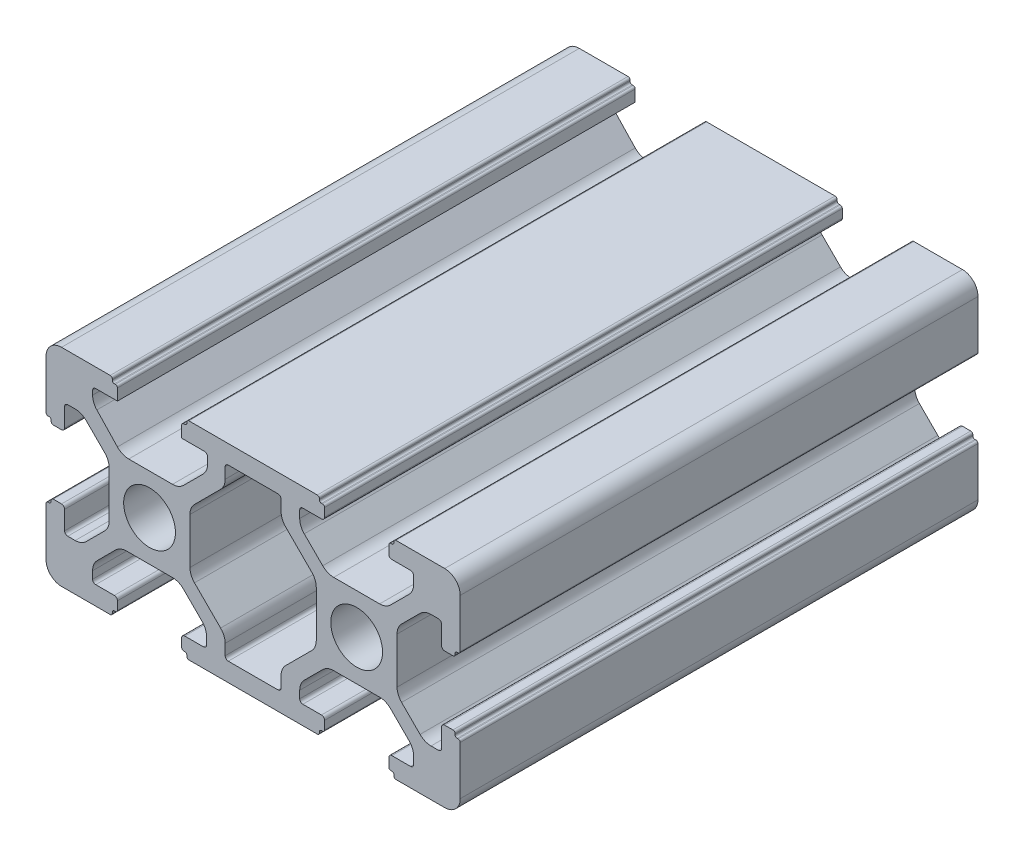
from build123d import *

# Parameters (mm, degrees)
SKETCH1_R           = 2.5
BOSS_EXTRUDE2_DEPTH = 50


with BuildPart() as part:
    # Sketch1 → Boss-Extrude2 (new body)
    with BuildSketch(Plane.XY):
        with BuildLine():
            Line((1.5, 0), (6.2, 0))
            ThreePointArc((6.2, 0), (6.341421356, 0.058578644), (6.4, 0.2))
            Line((6.4, 0.2), (6.4, 0.3))
            ThreePointArc((6.4, 0.3), (6.458578644, 0.441421356), (6.6, 0.5))
            Line((6.6, 0.5), (6.7, 0.5))
            ThreePointArc((6.7, 0.5), (6.841421356, 0.558578644), (6.9, 0.7))
            Line((6.9, 0.7), (6.9, 1.5))
            ThreePointArc((6.9, 1.5), (6.812132034, 1.712132034), (6.6, 1.8))
            Line((6.6, 1.8), (4.8, 1.8))
            ThreePointArc((4.8, 1.8), (4.587867966, 1.887867966), (4.5, 2.1))
            Line((4.5, 2.1), (4.5, 2.818019485))
            ThreePointArc((4.5, 2.818019485), (4.614180701, 3.392044633), (4.939339828, 3.878679656))
            Line((4.939339828, 3.878679656), (6.721320344, 5.660660172))
            ThreePointArc((6.721320344, 5.660660172), (7.207955367, 5.985819299), (7.781980515, 6.1))
            Line((7.781980515, 6.1), (12.218019485, 6.1))
            ThreePointArc((12.218019485, 6.1), (12.792044633, 5.985819299), (13.278679656, 5.660660172))
            Line((13.278679656, 5.660660172), (15.060660172, 3.878679656))
            ThreePointArc((15.060660172, 3.878679656), (15.385819299, 3.392044633), (15.5, 2.818019485))
            Line((15.5, 2.818019485), (15.5, 2.1))
            ThreePointArc((15.5, 2.1), (15.412132034, 1.887867966), (15.2, 1.8))
            Line((15.2, 1.8), (13.4, 1.8))
            ThreePointArc((13.4, 1.8), (13.187867966, 1.712132034), (13.1, 1.5))
            Line((13.1, 1.5), (13.1, 0.7))
            ThreePointArc((13.1, 0.7), (13.158578644, 0.558578644), (13.3, 0.5))
            Line((13.3, 0.5), (13.4, 0.5))
            ThreePointArc((13.4, 0.5), (13.541421356, 0.441421356), (13.6, 0.3))
            Line((13.6, 0.3), (13.6, 0.2))
            ThreePointArc((13.6, 0.2), (13.658578644, 0.058578644), (13.8, 0))
            Line((13.8, 0), (26.2, 0))
            ThreePointArc((26.2, 0), (26.341421356, 0.058578644), (26.4, 0.2))
            Line((26.4, 0.2), (26.4, 0.3))
            ThreePointArc((26.4, 0.3), (26.458578644, 0.441421356), (26.6, 0.5))
            Line((26.6, 0.5), (26.7, 0.5))
            ThreePointArc((26.7, 0.5), (26.841421356, 0.558578644), (26.9, 0.7))
            Line((26.9, 0.7), (26.9, 1.5))
            ThreePointArc((26.9, 1.5), (26.812132034, 1.712132034), (26.6, 1.8))
            Line((26.6, 1.8), (24.8, 1.8))
            ThreePointArc((24.8, 1.8), (24.587867966, 1.887867966), (24.5, 2.1))
            Line((24.5, 2.1), (24.5, 2.818019485))
            ThreePointArc((24.5, 2.818019485), (24.614180701, 3.392044633), (24.939339828, 3.878679656))
            Line((24.939339828, 3.878679656), (26.721320344, 5.660660172))
            ThreePointArc((26.721320344, 5.660660172), (27.207955367, 5.985819299), (27.781980515, 6.1))
            Line((27.781980515, 6.1), (32.218019485, 6.1))
            ThreePointArc((32.218019485, 6.1), (32.792044633, 5.985819299), (33.278679656, 5.660660172))
            Line((33.278679656, 5.660660172), (35.060660172, 3.878679656))
            ThreePointArc((35.060660172, 3.878679656), (35.385819299, 3.392044633), (35.5, 2.818019485))
            Line((35.5, 2.818019485), (35.5, 2.1))
            ThreePointArc((35.5, 2.1), (35.412132034, 1.887867966), (35.2, 1.8))
            Line((35.2, 1.8), (33.4, 1.8))
            ThreePointArc((33.4, 1.8), (33.187867966, 1.712132034), (33.1, 1.5))
            Line((33.1, 1.5), (33.1, 0.7))
            ThreePointArc((33.1, 0.7), (33.158578644, 0.558578644), (33.3, 0.5))
            Line((33.3, 0.5), (33.4, 0.5))
            ThreePointArc((33.4, 0.5), (33.541421356, 0.441421356), (33.6, 0.3))
            Line((33.6, 0.3), (33.6, 0.2))
            ThreePointArc((33.6, 0.2), (33.658578644, 0.058578644), (33.8, 0))
            Line((33.8, 0), (38.5, 0))
            ThreePointArc((38.5, 0), (39.560660172, 0.439339828), (40, 1.5))
            Line((40, 1.5), (40, 6.2))
            ThreePointArc((40, 6.2), (39.941421356, 6.341421356), (39.8, 6.4))
            Line((39.8, 6.4), (39.7, 6.4))
            ThreePointArc((39.7, 6.4), (39.558578644, 6.458578644), (39.5, 6.6))
            Line((39.5, 6.6), (39.5, 6.7))
            ThreePointArc((39.5, 6.7), (39.441421356, 6.841421356), (39.3, 6.9))
            Line((39.3, 6.9), (38.5, 6.9))
            ThreePointArc((38.5, 6.9), (38.287867966, 6.812132034), (38.2, 6.6))
            Line((38.2, 6.6), (38.2, 4.8))
            ThreePointArc((38.2, 4.8), (38.112132034, 4.587867966), (37.9, 4.5))
            Line((37.9, 4.5), (37.181980515, 4.5))
            ThreePointArc((37.181980515, 4.5), (36.607955367, 4.614180701), (36.121320344, 4.939339828))
            Line((36.121320344, 4.939339828), (34.339339828, 6.721320344))
            ThreePointArc((34.339339828, 6.721320344), (34.014180701, 7.207955367), (33.9, 7.781980515))
            Line((33.9, 7.781980515), (33.9, 12.218019485))
            ThreePointArc((33.9, 12.218019485), (34.014180701, 12.792044633), (34.339339828, 13.278679656))
            Line((34.339339828, 13.278679656), (36.121320344, 15.060660172))
            ThreePointArc((36.121320344, 15.060660172), (36.607955367, 15.385819299), (37.181980515, 15.5))
            Line((37.181980515, 15.5), (37.9, 15.5))
            ThreePointArc((37.9, 15.5), (38.112132034, 15.412132034), (38.2, 15.2))
            Line((38.2, 15.2), (38.2, 13.4))
            ThreePointArc((38.2, 13.4), (38.287867966, 13.187867966), (38.5, 13.1))
            Line((38.5, 13.1), (39.3, 13.1))
            ThreePointArc((39.3, 13.1), (39.441421356, 13.158578644), (39.5, 13.3))
            Line((39.5, 13.3), (39.5, 13.4))
            ThreePointArc((39.5, 13.4), (39.558578644, 13.541421356), (39.7, 13.6))
            Line((39.7, 13.6), (39.8, 13.6))
            ThreePointArc((39.8, 13.6), (39.941421356, 13.658578644), (40, 13.8))
            Line((40, 13.8), (40, 18.5))
            ThreePointArc((40, 18.5), (39.560660172, 19.560660172), (38.5, 20))
            Line((38.5, 20), (33.8, 20))
            ThreePointArc((33.8, 20), (33.658578644, 19.941421356), (33.6, 19.8))
            Line((33.6, 19.8), (33.6, 19.7))
            ThreePointArc((33.6, 19.7), (33.541421356, 19.558578644), (33.4, 19.5))
            Line((33.4, 19.5), (33.3, 19.5))
            ThreePointArc((33.3, 19.5), (33.158578644, 19.441421356), (33.1, 19.3))
            Line((33.1, 19.3), (33.1, 18.5))
            ThreePointArc((33.1, 18.5), (33.187867966, 18.287867966), (33.4, 18.2))
            Line((33.4, 18.2), (35.2, 18.2))
            ThreePointArc((35.2, 18.2), (35.412132034, 18.112132034), (35.5, 17.9))
            Line((35.5, 17.9), (35.5, 17.181980515))
            ThreePointArc((35.5, 17.181980515), (35.385819299, 16.607955367), (35.060660172, 16.121320344))
            Line((35.060660172, 16.121320344), (33.278679656, 14.339339828))
            ThreePointArc((33.278679656, 14.339339828), (32.792044633, 14.014180701), (32.218019485, 13.9))
            Line((32.218019485, 13.9), (27.781980515, 13.9))
            ThreePointArc((27.781980515, 13.9), (27.207955367, 14.014180701), (26.721320344, 14.339339828))
            Line((26.721320344, 14.339339828), (24.939339828, 16.121320344))
            ThreePointArc((24.939339828, 16.121320344), (24.614180701, 16.607955367), (24.5, 17.181980515))
            Line((24.5, 17.181980515), (24.5, 17.9))
            ThreePointArc((24.5, 17.9), (24.587867966, 18.112132034), (24.8, 18.2))
            Line((24.8, 18.2), (26.6, 18.2))
            ThreePointArc((26.6, 18.2), (26.812132034, 18.287867966), (26.9, 18.5))
            Line((26.9, 18.5), (26.9, 19.3))
            ThreePointArc((26.9, 19.3), (26.841421356, 19.441421356), (26.7, 19.5))
            Line((26.7, 19.5), (26.6, 19.5))
            ThreePointArc((26.6, 19.5), (26.458578644, 19.558578644), (26.4, 19.7))
            Line((26.4, 19.7), (26.4, 19.8))
            ThreePointArc((26.4, 19.8), (26.341421356, 19.941421356), (26.2, 20))
            Line((26.2, 20), (13.8, 20))
            ThreePointArc((13.8, 20), (13.658578644, 19.941421356), (13.6, 19.8))
            Line((13.6, 19.8), (13.6, 19.7))
            ThreePointArc((13.6, 19.7), (13.541421356, 19.558578644), (13.4, 19.5))
            Line((13.4, 19.5), (13.3, 19.5))
            ThreePointArc((13.3, 19.5), (13.158578644, 19.441421356), (13.1, 19.3))
            Line((13.1, 19.3), (13.1, 18.2))
            Line((13.1, 18.2), (15.3, 18.2))
            ThreePointArc((15.3, 18.2), (15.512132034, 18.112132034), (15.6, 17.9))
            Line((15.6, 17.9), (15.6, 17.281980515))
            ThreePointArc((15.6, 17.281980515), (15.485819299, 16.707955367), (15.160660172, 16.221320344))
            Line((15.160660172, 16.221320344), (13.278679656, 14.339339828))
            ThreePointArc((13.278679656, 14.339339828), (12.792044633, 14.014180701), (12.218019485, 13.9))
            Line((12.218019485, 13.9), (7.986375635, 13.9))
            ThreePointArc((7.986375635, 13.9), (7.393381044, 14.022191082), (6.896997987, 14.36885678))
            Line((6.896997987, 14.36885678), (4.910622352, 16.467414163))
            ThreePointArc((4.910622352, 16.467414163), (4.606431474, 16.943609851), (4.5, 17.498557383))
            Line((4.5, 17.498557383), (4.5, 17.9))
            ThreePointArc((4.5, 17.9), (4.587867966, 18.112132034), (4.8, 18.2))
            Line((4.8, 18.2), (6.9, 18.2))
            Line((6.9, 18.2), (6.9, 19.3))
            ThreePointArc((6.9, 19.3), (6.841421356, 19.441421356), (6.7, 19.5))
            Line((6.7, 19.5), (6.6, 19.5))
            ThreePointArc((6.6, 19.5), (6.458578644, 19.558578644), (6.4, 19.7))
            Line((6.4, 19.7), (6.4, 19.8))
            ThreePointArc((6.4, 19.8), (6.341421356, 19.941421356), (6.2, 20))
            Line((6.2, 20), (1.5, 20))
            ThreePointArc((1.5, 20), (0.439339828, 19.560660172), (0, 18.5))
            Line((0, 18.5), (0, 13.8))
            ThreePointArc((0, 13.8), (0.058578644, 13.658578644), (0.2, 13.6))
            Line((0.2, 13.6), (0.3, 13.6))
            ThreePointArc((0.3, 13.6), (0.441421356, 13.541421356), (0.5, 13.4))
            Line((0.5, 13.4), (0.5, 13.3))
            ThreePointArc((0.5, 13.3), (0.558578644, 13.158578644), (0.7, 13.1))
            Line((0.7, 13.1), (1.5, 13.1))
            ThreePointArc((1.5, 13.1), (1.712132034, 13.187867966), (1.8, 13.4))
            Line((1.8, 13.4), (1.8, 15.2))
            ThreePointArc((1.8, 15.2), (1.887867966, 15.412132034), (2.1, 15.5))
            Line((2.1, 15.5), (2.818019485, 15.5))
            ThreePointArc((2.818019485, 15.5), (3.392044633, 15.385819299), (3.878679656, 15.060660172))
            Line((3.878679656, 15.060660172), (5.660660172, 13.278679656))
            ThreePointArc((5.660660172, 13.278679656), (5.985819299, 12.792044633), (6.1, 12.218019485))
            Line((6.1, 12.218019485), (6.1, 7.781980515))
            ThreePointArc((6.1, 7.781980515), (5.985819299, 7.207955367), (5.660660172, 6.721320344))
            Line((5.660660172, 6.721320344), (3.878679656, 4.939339828))
            ThreePointArc((3.878679656, 4.939339828), (3.392044633, 4.614180701), (2.818019485, 4.5))
            Line((2.818019485, 4.5), (2.1, 4.5))
            ThreePointArc((2.1, 4.5), (1.887867966, 4.587867966), (1.8, 4.8))
            Line((1.8, 4.8), (1.8, 6.6))
            ThreePointArc((1.8, 6.6), (1.712132034, 6.812132034), (1.5, 6.9))
            Line((1.5, 6.9), (0.7, 6.9))
            ThreePointArc((0.7, 6.9), (0.558578644, 6.841421356), (0.5, 6.7))
            Line((0.5, 6.7), (0.5, 6.6))
            ThreePointArc((0.5, 6.6), (0.441421356, 6.458578644), (0.3, 6.4))
            Line((0.3, 6.4), (0.2, 6.4))
            ThreePointArc((0.2, 6.4), (0.058578644, 6.341421356), (0, 6.2))
            Line((0, 6.2), (0, 1.5))
            ThreePointArc((0, 1.5), (0.439339828, 0.439339828), (1.5, 0))
        make_face()
        with Locations((10, 10)):
            Circle(SKETCH1_R, mode=Mode.SUBTRACT)
        with Locations((30, 10)):
            Circle(SKETCH1_R, mode=Mode.SUBTRACT)
        with BuildLine():
            Line((17.6, 1.8), (22.4, 1.8))
            ThreePointArc((22.4, 1.8), (22.612132034, 1.887867966), (22.7, 2.1))
            Line((22.7, 2.1), (22.7, 3.139339828))
            ThreePointArc((22.7, 3.139339828), (22.814180701, 3.713364977), (23.139339828, 4.2))
            Line((23.139339828, 4.2), (25.660660172, 6.721320344))
            ThreePointArc((25.660660172, 6.721320344), (25.985819299, 7.207955367), (26.1, 7.781980515))
            Line((26.1, 7.781980515), (26.1, 12.218019485))
            ThreePointArc((26.1, 12.218019485), (25.985819299, 12.792044633), (25.660660172, 13.278679656))
            Line((25.660660172, 13.278679656), (23.139339828, 15.8))
            ThreePointArc((23.139339828, 15.8), (22.814180701, 16.286635023), (22.7, 16.860660172))
            Line((22.7, 16.860660172), (22.7, 17.9))
            ThreePointArc((22.7, 17.9), (22.612132034, 18.112132034), (22.4, 18.2))
            Line((22.4, 18.2), (17.6, 18.2))
            ThreePointArc((17.6, 18.2), (17.387867966, 18.112132034), (17.3, 17.9))
            Line((17.3, 17.9), (17.3, 16.860660172))
            ThreePointArc((17.3, 16.860660172), (17.185819299, 16.286635023), (16.860660172, 15.8))
            Line((16.860660172, 15.8), (14.339339828, 13.278679656))
            ThreePointArc((14.339339828, 13.278679656), (14.014180701, 12.792044633), (13.9, 12.218019485))
            Line((13.9, 12.218019485), (13.9, 7.781980515))
            ThreePointArc((13.9, 7.781980515), (14.014180701, 7.207955367), (14.339339828, 6.721320344))
            Line((14.339339828, 6.721320344), (16.860660172, 4.2))
            ThreePointArc((16.860660172, 4.2), (17.185819299, 3.713364977), (17.3, 3.139339828))
            Line((17.3, 3.139339828), (17.3, 2.1))
            ThreePointArc((17.3, 2.1), (17.387867966, 1.887867966), (17.6, 1.8))
        make_face(mode=Mode.SUBTRACT)
    extrude(amount=BOSS_EXTRUDE2_DEPTH)


solid = part.part
